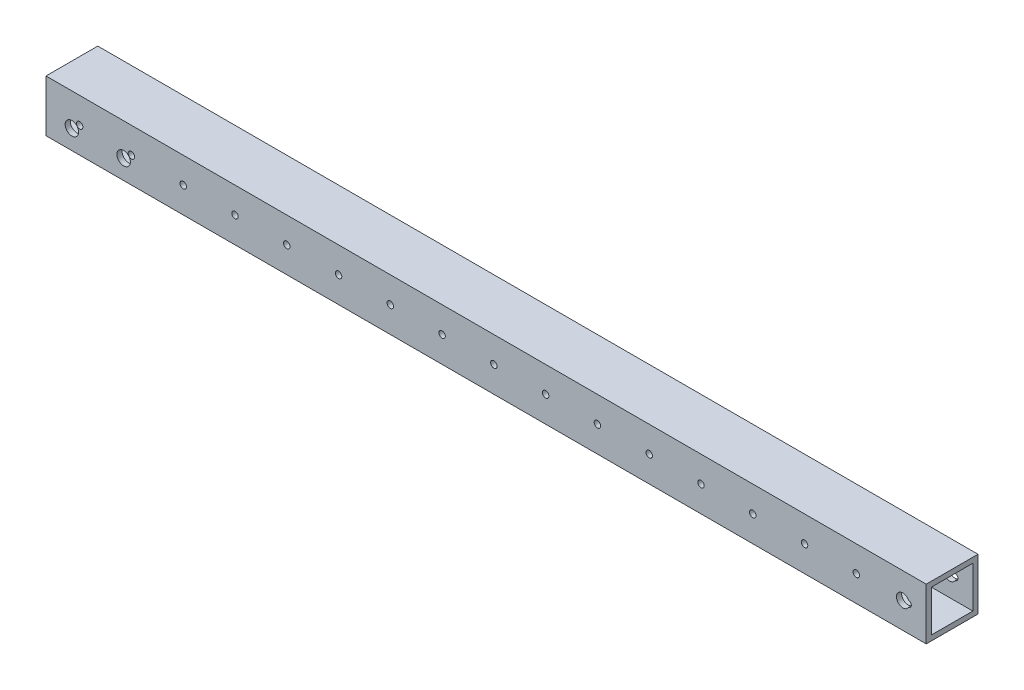
from build123d import *

# Parameters (mm, degrees)
SKETCH1_W           = 431.8
SKETCH1_H           = 25.4
BOSS_EXTRUDE1_DEPTH = 25.4
SKETCH2_W           = 20.32
SKETCH2_H           = 20.32
CUT_EXTRUDE1_DEPTH  = 433.740344914
CUT_EXTRUDE2_REACH  = 344.058
SKETCH3_R           = 1.5875
CUT_EXTRUDE3_REACH  = 344.755
SKETCH4_R           = 3.175
SKETCH4_R_2         = 3.302


with BuildPart() as part:
    # Sketch1 → Boss-Extrude1 (new body)
    with BuildSketch(Plane(origin=(0, 0, 0), x_dir=(1, 0, 0), z_dir=(0, 1, 0))):
        with Locations((124.968, -0.254)):
            Rectangle(SKETCH1_W, SKETCH1_H)
    extrude(amount=BOSS_EXTRUDE1_DEPTH)

    # Sketch2 → Cut-Extrude1 (cut, through all)
    with BuildSketch(Plane.ZY.offset(90.932)):
        with Locations((0.254, 12.7)):
            Rectangle(SKETCH2_W, SKETCH2_H)
    extrude(amount=-CUT_EXTRUDE1_DEPTH, mode=Mode.SUBTRACT)

    # Cut-Extrude2: up to this face of the body (flat: up to its plane)
    cut_extrude2_end = Plane(part.part.faces().sort_by_distance((124.968, 12.7, -12.446))[0])
    # Sketch3 → Cut-Extrude2 (cut, up to the picked face)
    with BuildSketch(Plane(origin=(0, 12.446, 12.954), x_dir=(1, 0, 0), z_dir=(0, 0, -1)), mode=Mode.PRIVATE) as cut_extrude2_sk1:
        with Locations((-74.422, -0.254)):
            Circle(SKETCH3_R)
    cut_extrude2_tool1 = split(extrude(cut_extrude2_sk1.sketch, amount=CUT_EXTRUDE2_REACH, mode=Mode.PRIVATE), bisect_by=cut_extrude2_end, keep=Keep.BOTH, mode=Mode.PRIVATE)
    # Sketch3 → Cut-Extrude2 (cut, up to the picked face)
    with BuildSketch(Plane(origin=(0, 12.446, 12.954), x_dir=(1, 0, 0), z_dir=(0, 0, -1)), mode=Mode.PRIVATE) as cut_extrude2_sk2:
        with Locations((-49.022, -0.254)):
            Circle(SKETCH3_R)
    cut_extrude2_tool2 = split(extrude(cut_extrude2_sk2.sketch, amount=CUT_EXTRUDE2_REACH, mode=Mode.PRIVATE), bisect_by=cut_extrude2_end, keep=Keep.BOTH, mode=Mode.PRIVATE)
    # Sketch3 → Cut-Extrude2 (cut, up to the picked face)
    with BuildSketch(Plane(origin=(0, 12.446, 12.954), x_dir=(1, 0, 0), z_dir=(0, 0, -1)), mode=Mode.PRIVATE) as cut_extrude2_sk3:
        with Locations((-23.622, -0.254)):
            Circle(SKETCH3_R)
    cut_extrude2_tool3 = split(extrude(cut_extrude2_sk3.sketch, amount=CUT_EXTRUDE2_REACH, mode=Mode.PRIVATE), bisect_by=cut_extrude2_end, keep=Keep.BOTH, mode=Mode.PRIVATE)
    # Sketch3 → Cut-Extrude2 (cut, up to the picked face)
    with BuildSketch(Plane(origin=(0, 12.446, 12.954), x_dir=(1, 0, 0), z_dir=(0, 0, -1)), mode=Mode.PRIVATE) as cut_extrude2_sk4:
        with Locations((1.778, -0.254)):
            Circle(SKETCH3_R)
    cut_extrude2_tool4 = split(extrude(cut_extrude2_sk4.sketch, amount=CUT_EXTRUDE2_REACH, mode=Mode.PRIVATE), bisect_by=cut_extrude2_end, keep=Keep.BOTH, mode=Mode.PRIVATE)
    # Sketch3 → Cut-Extrude2 (cut, up to the picked face)
    with BuildSketch(Plane(origin=(0, 12.446, 12.954), x_dir=(1, 0, 0), z_dir=(0, 0, -1)), mode=Mode.PRIVATE) as cut_extrude2_sk5:
        with Locations((27.178, -0.254)):
            Circle(SKETCH3_R)
    cut_extrude2_tool5 = split(extrude(cut_extrude2_sk5.sketch, amount=CUT_EXTRUDE2_REACH, mode=Mode.PRIVATE), bisect_by=cut_extrude2_end, keep=Keep.BOTH, mode=Mode.PRIVATE)
    # Sketch3 → Cut-Extrude2 (cut, up to the picked face)
    with BuildSketch(Plane(origin=(0, 12.446, 12.954), x_dir=(1, 0, 0), z_dir=(0, 0, -1)), mode=Mode.PRIVATE) as cut_extrude2_sk6:
        with Locations((52.578, -0.254)):
            Circle(SKETCH3_R)
    cut_extrude2_tool6 = split(extrude(cut_extrude2_sk6.sketch, amount=CUT_EXTRUDE2_REACH, mode=Mode.PRIVATE), bisect_by=cut_extrude2_end, keep=Keep.BOTH, mode=Mode.PRIVATE)
    # Sketch3 → Cut-Extrude2 (cut, up to the picked face)
    with BuildSketch(Plane(origin=(0, 12.446, 12.954), x_dir=(1, 0, 0), z_dir=(0, 0, -1)), mode=Mode.PRIVATE) as cut_extrude2_sk7:
        with Locations((77.978, -0.254)):
            Circle(SKETCH3_R)
    cut_extrude2_tool7 = split(extrude(cut_extrude2_sk7.sketch, amount=CUT_EXTRUDE2_REACH, mode=Mode.PRIVATE), bisect_by=cut_extrude2_end, keep=Keep.BOTH, mode=Mode.PRIVATE)
    # Sketch3 → Cut-Extrude2 (cut, up to the picked face)
    with BuildSketch(Plane(origin=(0, 12.446, 12.954), x_dir=(1, 0, 0), z_dir=(0, 0, -1)), mode=Mode.PRIVATE) as cut_extrude2_sk8:
        with Locations((103.378, -0.254)):
            Circle(SKETCH3_R)
    cut_extrude2_tool8 = split(extrude(cut_extrude2_sk8.sketch, amount=CUT_EXTRUDE2_REACH, mode=Mode.PRIVATE), bisect_by=cut_extrude2_end, keep=Keep.BOTH, mode=Mode.PRIVATE)
    # Sketch3 → Cut-Extrude2 (cut, up to the picked face)
    with BuildSketch(Plane(origin=(0, 12.446, 12.954), x_dir=(1, 0, 0), z_dir=(0, 0, -1)), mode=Mode.PRIVATE) as cut_extrude2_sk9:
        with Locations((128.778, -0.254)):
            Circle(SKETCH3_R)
    cut_extrude2_tool9 = split(extrude(cut_extrude2_sk9.sketch, amount=CUT_EXTRUDE2_REACH, mode=Mode.PRIVATE), bisect_by=cut_extrude2_end, keep=Keep.BOTH, mode=Mode.PRIVATE)
    # Sketch3 → Cut-Extrude2 (cut, up to the picked face)
    with BuildSketch(Plane(origin=(0, 12.446, 12.954), x_dir=(1, 0, 0), z_dir=(0, 0, -1)), mode=Mode.PRIVATE) as cut_extrude2_sk10:
        with Locations((154.178, -0.254)):
            Circle(SKETCH3_R)
    cut_extrude2_tool10 = split(extrude(cut_extrude2_sk10.sketch, amount=CUT_EXTRUDE2_REACH, mode=Mode.PRIVATE), bisect_by=cut_extrude2_end, keep=Keep.BOTH, mode=Mode.PRIVATE)
    # Sketch3 → Cut-Extrude2 (cut, up to the picked face)
    with BuildSketch(Plane(origin=(0, 12.446, 12.954), x_dir=(1, 0, 0), z_dir=(0, 0, -1)), mode=Mode.PRIVATE) as cut_extrude2_sk11:
        with Locations((179.578, -0.254)):
            Circle(SKETCH3_R)
    cut_extrude2_tool11 = split(extrude(cut_extrude2_sk11.sketch, amount=CUT_EXTRUDE2_REACH, mode=Mode.PRIVATE), bisect_by=cut_extrude2_end, keep=Keep.BOTH, mode=Mode.PRIVATE)
    # Sketch3 → Cut-Extrude2 (cut, up to the picked face)
    with BuildSketch(Plane(origin=(0, 12.446, 12.954), x_dir=(1, 0, 0), z_dir=(0, 0, -1)), mode=Mode.PRIVATE) as cut_extrude2_sk12:
        with Locations((204.978, -0.254)):
            Circle(SKETCH3_R)
    cut_extrude2_tool12 = split(extrude(cut_extrude2_sk12.sketch, amount=CUT_EXTRUDE2_REACH, mode=Mode.PRIVATE), bisect_by=cut_extrude2_end, keep=Keep.BOTH, mode=Mode.PRIVATE)
    # Sketch3 → Cut-Extrude2 (cut, up to the picked face)
    with BuildSketch(Plane(origin=(0, 12.446, 12.954), x_dir=(1, 0, 0), z_dir=(0, 0, -1)), mode=Mode.PRIVATE) as cut_extrude2_sk13:
        with Locations((230.378, -0.254)):
            Circle(SKETCH3_R)
    cut_extrude2_tool13 = split(extrude(cut_extrude2_sk13.sketch, amount=CUT_EXTRUDE2_REACH, mode=Mode.PRIVATE), bisect_by=cut_extrude2_end, keep=Keep.BOTH, mode=Mode.PRIVATE)
    # Sketch3 → Cut-Extrude2 (cut, up to the picked face)
    with BuildSketch(Plane(origin=(0, 12.446, 12.954), x_dir=(1, 0, 0), z_dir=(0, 0, -1)), mode=Mode.PRIVATE) as cut_extrude2_sk14:
        with Locations((255.778, -0.254)):
            Circle(SKETCH3_R)
    cut_extrude2_tool14 = split(extrude(cut_extrude2_sk14.sketch, amount=CUT_EXTRUDE2_REACH, mode=Mode.PRIVATE), bisect_by=cut_extrude2_end, keep=Keep.BOTH, mode=Mode.PRIVATE)
    # Sketch3 → Cut-Extrude2 (cut, up to the picked face)
    with BuildSketch(Plane(origin=(0, 12.446, 12.954), x_dir=(1, 0, 0), z_dir=(0, 0, -1)), mode=Mode.PRIVATE) as cut_extrude2_sk15:
        with Locations((281.178, -0.254)):
            Circle(SKETCH3_R)
    cut_extrude2_tool15 = split(extrude(cut_extrude2_sk15.sketch, amount=CUT_EXTRUDE2_REACH, mode=Mode.PRIVATE), bisect_by=cut_extrude2_end, keep=Keep.BOTH, mode=Mode.PRIVATE)
    # Sketch3 → Cut-Extrude2 (cut, up to the picked face)
    with BuildSketch(Plane(origin=(0, 12.446, 12.954), x_dir=(1, 0, 0), z_dir=(0, 0, -1)), mode=Mode.PRIVATE) as cut_extrude2_sk16:
        with Locations((306.578, -0.254)):
            Circle(SKETCH3_R)
    cut_extrude2_tool16 = split(extrude(cut_extrude2_sk16.sketch, amount=CUT_EXTRUDE2_REACH, mode=Mode.PRIVATE), bisect_by=cut_extrude2_end, keep=Keep.BOTH, mode=Mode.PRIVATE)
    # Sketch3 → Cut-Extrude2 (cut, up to the picked face)
    with BuildSketch(Plane(origin=(0, 12.446, 12.954), x_dir=(1, 0, 0), z_dir=(0, 0, -1)), mode=Mode.PRIVATE) as cut_extrude2_sk17:
        with Locations((331.978, -0.254)):
            Circle(SKETCH3_R)
    cut_extrude2_tool17 = split(extrude(cut_extrude2_sk17.sketch, amount=CUT_EXTRUDE2_REACH, mode=Mode.PRIVATE), bisect_by=cut_extrude2_end, keep=Keep.BOTH, mode=Mode.PRIVATE)
    add(cut_extrude2_tool1.solids().sort_by(Axis((-74.422, 12.7, 12.954), (0, 0, -1)))[0], mode=Mode.SUBTRACT)
    add(cut_extrude2_tool2.solids().sort_by(Axis((-49.022, 12.7, 12.954), (0, 0, -1)))[0], mode=Mode.SUBTRACT)
    add(cut_extrude2_tool3.solids().sort_by(Axis((-23.622, 12.7, 12.954), (0, 0, -1)))[0], mode=Mode.SUBTRACT)
    add(cut_extrude2_tool4.solids().sort_by(Axis((1.778, 12.7, 12.954), (0, 0, -1)))[0], mode=Mode.SUBTRACT)
    add(cut_extrude2_tool5.solids().sort_by(Axis((27.178, 12.7, 12.954), (0, 0, -1)))[0], mode=Mode.SUBTRACT)
    add(cut_extrude2_tool6.solids().sort_by(Axis((52.578, 12.7, 12.954), (0, 0, -1)))[0], mode=Mode.SUBTRACT)
    add(cut_extrude2_tool7.solids().sort_by(Axis((77.978, 12.7, 12.954), (0, 0, -1)))[0], mode=Mode.SUBTRACT)
    add(cut_extrude2_tool8.solids().sort_by(Axis((103.378, 12.7, 12.954), (0, 0, -1)))[0], mode=Mode.SUBTRACT)
    add(cut_extrude2_tool9.solids().sort_by(Axis((128.778, 12.7, 12.954), (0, 0, -1)))[0], mode=Mode.SUBTRACT)
    add(cut_extrude2_tool10.solids().sort_by(Axis((154.178, 12.7, 12.954), (0, 0, -1)))[0], mode=Mode.SUBTRACT)
    add(cut_extrude2_tool11.solids().sort_by(Axis((179.578, 12.7, 12.954), (0, 0, -1)))[0], mode=Mode.SUBTRACT)
    add(cut_extrude2_tool12.solids().sort_by(Axis((204.978, 12.7, 12.954), (0, 0, -1)))[0], mode=Mode.SUBTRACT)
    add(cut_extrude2_tool13.solids().sort_by(Axis((230.378, 12.7, 12.954), (0, 0, -1)))[0], mode=Mode.SUBTRACT)
    add(cut_extrude2_tool14.solids().sort_by(Axis((255.778, 12.7, 12.954), (0, 0, -1)))[0], mode=Mode.SUBTRACT)
    add(cut_extrude2_tool15.solids().sort_by(Axis((281.178, 12.7, 12.954), (0, 0, -1)))[0], mode=Mode.SUBTRACT)
    add(cut_extrude2_tool16.solids().sort_by(Axis((306.578, 12.7, 12.954), (0, 0, -1)))[0], mode=Mode.SUBTRACT)
    add(cut_extrude2_tool17.solids().sort_by(Axis((331.978, 12.7, 12.954), (0, 0, -1)))[0], mode=Mode.SUBTRACT)

    # Cut-Extrude3: up to this face of the body (flat: up to its plane)
    cut_extrude3_end = Plane(part.part.faces().sort_by_distance((124.920663358, 12.7, -12.446))[0])
    # Sketch4 → Cut-Extrude3 (cut, up to the picked face)
    with BuildSketch(Plane.XY.offset(12.954), mode=Mode.PRIVATE) as cut_extrude3_sk1:
        with Locations((329.438, 12.763758165)):
            Circle(SKETCH4_R)
    cut_extrude3_tool1 = split(extrude(cut_extrude3_sk1.sketch, amount=-CUT_EXTRUDE3_REACH, mode=Mode.PRIVATE), bisect_by=cut_extrude3_end, keep=Keep.BOTH, mode=Mode.PRIVATE)
    # Sketch4 → Cut-Extrude3 (cut, up to the picked face)
    with BuildSketch(Plane.XY.offset(12.954), mode=Mode.PRIVATE) as cut_extrude3_sk2:
        with Locations((-78.232, 9.525)):
            Circle(SKETCH4_R_2)
    cut_extrude3_tool2 = split(extrude(cut_extrude3_sk2.sketch, amount=-CUT_EXTRUDE3_REACH, mode=Mode.PRIVATE), bisect_by=cut_extrude3_end, keep=Keep.BOTH, mode=Mode.PRIVATE)
    # Sketch4 → Cut-Extrude3 (cut, up to the picked face)
    with BuildSketch(Plane.XY.offset(12.954), mode=Mode.PRIVATE) as cut_extrude3_sk3:
        with Locations((-52.832, 9.525)):
            Circle(SKETCH4_R_2)
    cut_extrude3_tool3 = split(extrude(cut_extrude3_sk3.sketch, amount=-CUT_EXTRUDE3_REACH, mode=Mode.PRIVATE), bisect_by=cut_extrude3_end, keep=Keep.BOTH, mode=Mode.PRIVATE)
    add(cut_extrude3_tool1.solids().sort_by(Axis((329.438, 12.763758, 12.954), (0, 0, -1)))[0], mode=Mode.SUBTRACT)
    add(cut_extrude3_tool2.solids().sort_by(Axis((-78.232, 9.525, 12.954), (0, 0, -1)))[0], mode=Mode.SUBTRACT)
    add(cut_extrude3_tool3.solids().sort_by(Axis((-52.832, 9.525, 12.954), (0, 0, -1)))[0], mode=Mode.SUBTRACT)


solid = part.part
